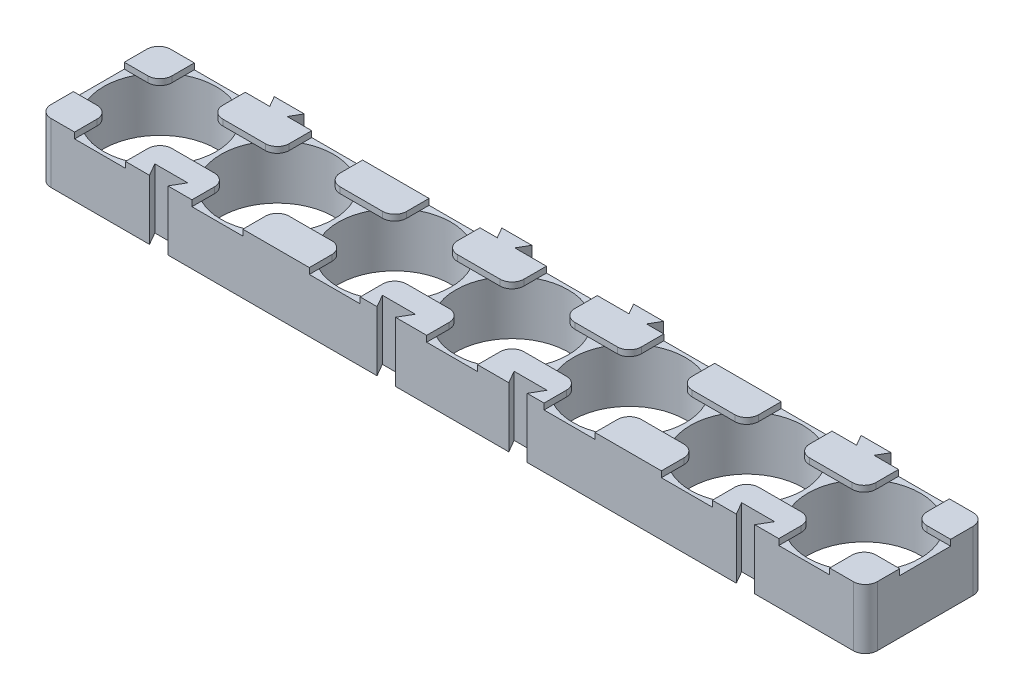
from build123d import *

# Parameters (mm, degrees)
SKETCH3_R              = 9.4
SKETCH3_R_2            = 9.400000000000007
SKETCH3_R_3            = 9.400000000000002
BOSS_EXTRUDE1_DEPTH    = 10
BOSS_EXTRUDE2_START    = -1
BOSS_EXTRUDE2_DEPTH    = 1
FILLET2_R              = 2
LPATTERN1_COUNT        = 7
LPATTERN1_PITCH        = 19.6
FILLET2_OF_LPATTERN1_R = 2
FILLET3_R              = 2
SKETCH4_5_W            = 137.99999999999994
SKETCH4_5_H            = 8.5
CUT_EXTRUDE2_DEPTH     = 1
SKETCH4_6_W            = 8.500000000000007
SKETCH4_6_H            = 19.999999999999993
CUT_EXTRUDE3_DEPTH     = 1
LPATTERN2_COUNT        = 7
LPATTERN2_PITCH        = 19.6


with BuildPart() as part:
    # Sketch3 → Boss-Extrude1 (new body)
    with BuildSketch(Plane(origin=(0, 0, 0), x_dir=(1, 0, 0), z_dir=(0, 1, 0))):
        Polygon((-69.00000000000003, 10.000000000000002), (-69.00000000000003, -10.000000000000002), (-50.53756443470182, -10.000000000000002), (-51.750000000000036, -7.899999999999998), (-46.25000000000003, -7.899999999999998), (-47.462435565298236, -9.999999999999998), (-12.537564434701821, -10.000000000000002), (-13.750000000000034, -7.899999999999998), (-8.250000000000028, -7.899999999999998), (-9.462435565298238, -9.999999999999998), (9.462435565298179, -10.000000000000002), (8.249999999999977, -7.899999999999998), (13.74999999999998, -7.899999999999998), (12.537564434701773, -9.999999999999998), (47.46243556529818, -10.000000000000002), (46.24999999999997, -7.899999999999998), (51.74999999999998, -7.899999999999998), (50.53756443470177, -9.999999999999998), (68.99999999999997, -10.000000000000002), (68.99999999999997, 9.999999999999998), (50.46076951545864, 9.999999999999998), (51.49999999999998, 11.8), (46.49999999999997, 11.8), (47.539230484541314, 10.000000000000002), (12.460769515458637, 10), (13.49999999999998, 11.8), (8.499999999999977, 11.8), (9.539230484541315, 10.000000000000002), (-9.53923048454137, 10), (-8.500000000000028, 11.8), (-13.500000000000032, 11.8), (-12.460769515458693, 10.000000000000002), (-47.53923048454137, 10.000000000000002), (-46.50000000000003, 11.8), (-51.50000000000003, 11.8), (-50.46076951545869, 10.000000000000002), align=None)
        with Locations((-58.80000000000003, -8.1599e-13)):
            Circle(SKETCH3_R, mode=Mode.SUBTRACT)
        with Locations((-39.20000000000004, -6.7913e-13)):
            Circle(SKETCH3_R, mode=Mode.SUBTRACT)
        with Locations((-19.600000000000033, -5.4226e-13)):
            Circle(SKETCH3_R, mode=Mode.SUBTRACT)
        Circle(SKETCH3_R, mode=Mode.SUBTRACT)
        with Locations((19.599999999999973, -2.6853e-13)):
            Circle(SKETCH3_R, mode=Mode.SUBTRACT)
        with Locations((39.199999999999974, -1.3166e-13)):
            Circle(SKETCH3_R_2, mode=Mode.SUBTRACT)
        with Locations((58.799999999999976, 5.2e-15)):
            Circle(SKETCH3_R_3, mode=Mode.SUBTRACT)
    extrude(amount=BOSS_EXTRUDE1_DEPTH)

    # Sketch4 → Boss-Extrude2 (add)
    with BuildSketch(Plane(origin=(0, 10, 0), x_dir=(1, 0, 0), z_dir=(0, 1, 0)).offset(BOSS_EXTRUDE2_START)):
        with BuildLine():
            Line((54.549999999999976, 4.25), (54.549999999999976, 8.384360440725105))
            ThreePointArc((54.549999999999685, 8.384360440725203), (52.1531962568464, 6.646803743153534), (50.41563955927475, 4.2500000000002425))
            Line((50.41563955927484, 4.25), (54.54999999999998, 4.25))
        make_face()
        with BuildLine():
            ThreePointArc((67.18436044072524, 4.250000000000159), (65.44680374315354, 6.646803743153543), (63.05000000000016, 8.384360440725256))
            Line((63.04999999999998, 8.38436044072519), (63.04999999999998, 4.25))
            Line((63.04999999999998, 4.25), (67.18436044072519, 4.25))
        make_face()
        with BuildLine():
            Line((54.54999999999998, -4.25), (50.41563955927484, -4.25))
            ThreePointArc((50.41563955927475, -4.250000000000238), (52.15319625684641, -6.646803743153529), (54.54999999999969, -8.384360440725196))
            Line((54.549999999999976, -8.384360440725096), (54.549999999999976, -4.25))
        make_face()
        with BuildLine():
            Line((67.18436044072519, -4.25), (63.04999999999998, -4.25))
            Line((63.04999999999998, -4.25), (63.04999999999998, -8.384360440725185))
            ThreePointArc((63.05000000000015, -8.384360440725251), (65.44680374315354, -6.646803743153541), (67.18436044072524, -4.250000000000151))
        make_face()
    boss_extrude2 = extrude(amount=BOSS_EXTRUDE2_DEPTH)

    # Fillet2
    fillet2_edges = [part.edges().sort_by_distance(p)[0] for p in [
        (54.54999999999998, 9.5, -4.25),
        (54.54999999999998, 9.5, 4.25),
        (63.04999999999998, 9.5, 4.25),
        (63.04999999999998, 9.5, -4.25),
    ]]
    fillet(fillet2_edges, radius=FILLET2_R)

    # LPattern1: Boss-Extrude2 ×7
    with Locations(*[(-i * LPATTERN1_PITCH, 0, 0) for i in range(1, LPATTERN1_COUNT)]):
        add(boss_extrude2)

    # Fillet2 of LPattern1
    fillet2_of_lpattern1_edges = [part.edges().sort_by_distance(p)[0] for p in [
        (34.94999999999998, 9.5, -4.25),
        (34.94999999999998, 9.5, 4.25),
        (43.44999999999998, 9.5, 4.25),
        (43.44999999999998, 9.5, -4.25),
        (15.34999999999998, 9.5, -4.25),
        (15.34999999999998, 9.5, 4.25),
        (23.84999999999998, 9.5, 4.25),
        (23.84999999999998, 9.5, -4.25),
        (-4.250000000000021, 9.5, -4.25),
        (-4.250000000000021, 9.5, 4.25),
        (4.249999999999979, 9.5, 4.25),
        (4.249999999999979, 9.5, -4.25),
        (-23.850000000000023, 9.5, -4.25),
        (-23.850000000000023, 9.5, 4.25),
        (-15.350000000000023, 9.5, 4.25),
        (-15.350000000000023, 9.5, -4.25),
        (-43.45000000000002, 9.5, -4.25),
        (-43.45000000000002, 9.5, 4.25),
        (-34.95000000000002, 9.5, 4.25),
        (-34.95000000000002, 9.5, -4.25),
        (-63.050000000000026, 9.5, -4.25),
        (-63.050000000000026, 9.5, 4.25),
        (-54.550000000000026, 9.5, 4.25),
        (-54.550000000000026, 9.5, -4.25),
    ]]
    fillet(fillet2_of_lpattern1_edges, radius=FILLET2_OF_LPATTERN1_R)

    # Fillet3
    fillet3_edges = [part.edges().sort_by_distance(p)[0] for p in [
        (68.99999999999997, 5, 10.000000000000002),
        (68.99999999999997, 5, -9.999999999999998),
        (-69.00000000000003, 5, 10.000000000000002),
        (-69.00000000000003, 5, -10.000000000000002),
    ]]
    fillet(fillet3_edges, radius=FILLET3_R)

    # Sketch4<5> → Cut-Extrude2 (cut)
    with BuildSketch(Plane(origin=(0, 10, 0), x_dir=(1, 0, 0), z_dir=(0, 1, 0))):
        Rectangle(SKETCH4_5_W, SKETCH4_5_H)
    extrude(amount=-CUT_EXTRUDE2_DEPTH, mode=Mode.SUBTRACT)

    # Sketch4<6> → Cut-Extrude3 (cut)
    with BuildSketch(Plane(origin=(0, 10, 0), x_dir=(1, 0, 0), z_dir=(0, 1, 0))):
        with Locations((58.79999999999998, 5.33e-15)):
            Rectangle(SKETCH4_6_W, SKETCH4_6_H)
    cut_extrude3 = extrude(amount=-CUT_EXTRUDE3_DEPTH, mode=Mode.SUBTRACT)

    # LPattern2: Cut-Extrude3 ×7
    with Locations(*[(-i * LPATTERN2_PITCH, 0, 0) for i in range(1, LPATTERN2_COUNT)]):
        add(cut_extrude3, mode=Mode.SUBTRACT)


solid = part.part
